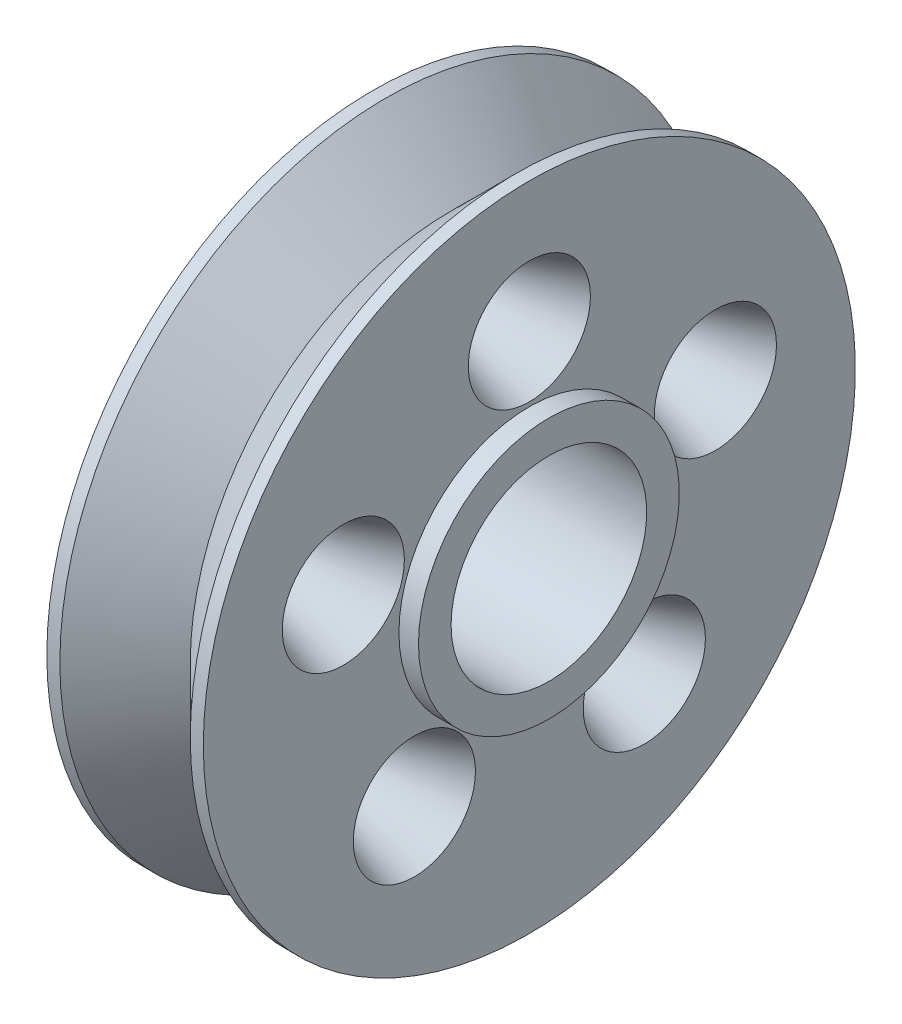
from build123d import *

# Parameters (mm, degrees)
IZIM2_R                           = 5
KES_EKSTR_ZYON3_DEPTH             = 12
KES_EKSTR_ZYON3_TAPER             = -20
KES_EKSTR_ZYON3_OTHER_WAY_DEPTH   = 12
KES_EKSTR_ZYON3_OTHER_WAY_DRAFT   = -20
DAIRESEL_KAPLAMA1_COUNT           = 5
DAIRESEL_KAPLAMA1_COPY_1_SKETCH_R = 5
DAIRESEL_KAPLAMA1_COPY_1_DEPTH    = 12
DAIRESEL_KAPLAMA1_COPY_1_DRAFT    = -20
DAIRESEL_KAPLAMA1_COPY_2_SKETCH_R = 5
DAIRESEL_KAPLAMA1_COPY_2_DEPTH    = 12
DAIRESEL_KAPLAMA1_COPY_2_DRAFT    = -20
DAIRESEL_KAPLAMA1_COPY_3_SKETCH_R = 5
DAIRESEL_KAPLAMA1_COPY_3_DEPTH    = 12
DAIRESEL_KAPLAMA1_COPY_3_DRAFT    = -20
DAIRESEL_KAPLAMA1_COPY_4_SKETCH_R = 5
DAIRESEL_KAPLAMA1_COPY_4_DEPTH    = 12
DAIRESEL_KAPLAMA1_COPY_4_DRAFT    = -20
DAIRESEL_KAPLAMA1_COPY_5_SKETCH_R = 5
DAIRESEL_KAPLAMA1_COPY_5_DEPTH    = 12
DAIRESEL_KAPLAMA1_COPY_5_DRAFT    = -20
DAIRESEL_KAPLAMA1_COPY_6_SKETCH_R = 5
DAIRESEL_KAPLAMA1_COPY_6_DEPTH    = 12
DAIRESEL_KAPLAMA1_COPY_6_DRAFT    = -20
DAIRESEL_KAPLAMA1_COPY_7_SKETCH_R = 5
DAIRESEL_KAPLAMA1_COPY_7_DEPTH    = 12
DAIRESEL_KAPLAMA1_COPY_7_DRAFT    = -20
DAIRESEL_KAPLAMA1_COPY_8_SKETCH_R = 5
DAIRESEL_KAPLAMA1_COPY_8_DEPTH    = 12
DAIRESEL_KAPLAMA1_COPY_8_DRAFT    = -20


with BuildPart() as part:
    # Çizim1 → Döndür1 (revolve)
    with BuildSketch(Plane.XY, mode=Mode.PRIVATE) as d_nd_r1_sk:
        Polygon((-10.136635142, 50), (-0.136635142, 40), (9.863364858, 50), (11.863364858, 50), (11.863364858, 20), (14.863364858, 20), (14.863364858, 15), (11.863364858, 15), (-12.136635142, 15), (-15.136635142, 15), (-15.136635142, 20), (-12.136635142, 20), (-12.136635142, 50), align=None)
    revolve(d_nd_r1_sk.sketch.rotate(Axis((-17.676704828, 0, 0), (1, 0, 0)), 90), axis=Axis((-17.676704828, 0, 0), (1, 0, 0)))

    # Çizim2 → Kes-Ekstrüzyon3 (cut)
    with BuildSketch(Plane(origin=(-0.136635142, 0, 0), x_dir=(0, 0, -1), z_dir=(1, 0, 0))):
        with Locations((0, 30)):
            Circle(IZIM2_R)
    kes_ekstr_zyon3 = extrude(amount=-KES_EKSTR_ZYON3_DEPTH, taper=KES_EKSTR_ZYON3_TAPER, mode=Mode.SUBTRACT)


with BuildPart() as kes_ekstr_zyon3_other_way_tool:
    # Çizim2 → Kes-Ekstrüzyon3 other way (with draft: the straight prism first)
    with BuildSketch(Plane(origin=(-0.136635142, 0, 0), x_dir=(0, 0, -1), z_dir=(1, 0, 0))):
        with Locations((0, 30)):
            Circle(IZIM2_R)
    extrude(amount=KES_EKSTR_ZYON3_OTHER_WAY_DEPTH)
    # Kes-Ekstrüzyon3 other way: the draft: its side faces are tilted about the plane it starts from
    kes_ekstr_zyon3_other_way_sides = [kes_ekstr_zyon3_other_way_tool.faces().sort_by_distance(p)[0] for p in [
        (5.863364858, 30, 5),
    ]]
    draft(kes_ekstr_zyon3_other_way_sides, Plane(origin=(-0.136635142, 0, 0), x_dir=(0, 0, -1), z_dir=(1, 0, 0)), KES_EKSTR_ZYON3_OTHER_WAY_DRAFT)


with BuildPart() as part_1:
    add(part.part)

    # Kes-Ekstrüzyon3 other way: cut by kes_ekstr_zyon3_other_way_tool
    add(kes_ekstr_zyon3_other_way_tool.part, mode=Mode.SUBTRACT)

    # Dairesel Kaplama1: Kes-Ekstrüzyon3 ×5 about axis
    dairesel_kaplama1_axis = Axis((0, 0, 0), (1, 0, 0))
    for i in range(1, DAIRESEL_KAPLAMA1_COUNT):
        add(kes_ekstr_zyon3.rotate(dairesel_kaplama1_axis, i * 360 / DAIRESEL_KAPLAMA1_COUNT), mode=Mode.SUBTRACT)


with BuildPart() as dairesel_kaplama1_copy_1_tool:
    # Dairesel Kaplama1 copy 1 sketch → Dairesel Kaplama1 copy 1 (with draft: the straight prism first)
    with BuildSketch(Plane(origin=(-0.136635142, 0, 0), x_dir=(0, 0.9510565162951535, -0.30901699437494745), z_dir=(1, 0, 0))):
        with Locations((0, 30)):
            Circle(DAIRESEL_KAPLAMA1_COPY_1_SKETCH_R)
    extrude(amount=DAIRESEL_KAPLAMA1_COPY_1_DEPTH)
    # Dairesel Kaplama1 copy 1: the draft: its side faces are tilted about the plane it starts from
    dairesel_kaplama1_copy_1_sides = [dairesel_kaplama1_copy_1_tool.faces().sort_by_distance(p)[0] for p in [
        (5.863364858, 4.51522725, 30.076780461),
    ]]
    draft(dairesel_kaplama1_copy_1_sides, Plane(origin=(-0.136635142, 0, 0), x_dir=(0, 0.9510565162951535, -0.30901699437494745), z_dir=(1, 0, 0)), DAIRESEL_KAPLAMA1_COPY_1_DRAFT)


with BuildPart() as part_2:
    add(part_1.part)

    # Dairesel Kaplama1 copy 1: cut by dairesel_kaplama1_copy_1_tool
    add(dairesel_kaplama1_copy_1_tool.part, mode=Mode.SUBTRACT)


with BuildPart() as dairesel_kaplama1_copy_2_tool:
    # Dairesel Kaplama1 copy 2 sketch → Dairesel Kaplama1 copy 2 (with draft: the straight prism first)
    with BuildSketch(Plane(origin=(-0.136635142, 0, 0), x_dir=(0, 0.5877852522924732, 0.8090169943749473), z_dir=(1, 0, 0))):
        with Locations((0, 30)):
            Circle(DAIRESEL_KAPLAMA1_COPY_2_SKETCH_R)
    extrude(amount=DAIRESEL_KAPLAMA1_COPY_2_DEPTH)
    # Dairesel Kaplama1 copy 2: the draft: its side faces are tilted about the plane it starts from
    dairesel_kaplama1_copy_2_sides = [dairesel_kaplama1_copy_2_tool.faces().sort_by_distance(p)[0] for p in [
        (5.863364858, -27.209436093, 13.588472597),
    ]]
    draft(dairesel_kaplama1_copy_2_sides, Plane(origin=(-0.136635142, 0, 0), x_dir=(0, 0.5877852522924732, 0.8090169943749473), z_dir=(1, 0, 0)), DAIRESEL_KAPLAMA1_COPY_2_DRAFT)


with BuildPart() as part_3:
    add(part_2.part)

    # Dairesel Kaplama1 copy 2: cut by dairesel_kaplama1_copy_2_tool
    add(dairesel_kaplama1_copy_2_tool.part, mode=Mode.SUBTRACT)


with BuildPart() as dairesel_kaplama1_copy_3_tool:
    # Dairesel Kaplama1 copy 3 sketch → Dairesel Kaplama1 copy 3 (with draft: the straight prism first)
    with BuildSketch(Plane(origin=(-0.136635142, 0, 0), x_dir=(0, -0.587785252292473, 0.8090169943749476), z_dir=(1, 0, 0))):
        with Locations((0, 30)):
            Circle(DAIRESEL_KAPLAMA1_COPY_3_SKETCH_R)
    extrude(amount=DAIRESEL_KAPLAMA1_COPY_3_DEPTH)
    # Dairesel Kaplama1 copy 3: the draft: its side faces are tilted about the plane it starts from
    dairesel_kaplama1_copy_3_sides = [dairesel_kaplama1_copy_3_tool.faces().sort_by_distance(p)[0] for p in [
        (5.863364858, -21.33158357, -21.678642541),
    ]]
    draft(dairesel_kaplama1_copy_3_sides, Plane(origin=(-0.136635142, 0, 0), x_dir=(0, -0.587785252292473, 0.8090169943749476), z_dir=(1, 0, 0)), DAIRESEL_KAPLAMA1_COPY_3_DRAFT)


with BuildPart() as part_4:
    add(part_3.part)

    # Dairesel Kaplama1 copy 3: cut by dairesel_kaplama1_copy_3_tool
    add(dairesel_kaplama1_copy_3_tool.part, mode=Mode.SUBTRACT)


with BuildPart() as dairesel_kaplama1_copy_4_tool:
    # Dairesel Kaplama1 copy 4 sketch → Dairesel Kaplama1 copy 4 (with draft: the straight prism first)
    with BuildSketch(Plane(origin=(-0.136635142, 0, 0), x_dir=(0, -0.9510565162951536, -0.30901699437494723), z_dir=(1, 0, 0))):
        with Locations((0, 30)):
            Circle(DAIRESEL_KAPLAMA1_COPY_4_SKETCH_R)
    extrude(amount=DAIRESEL_KAPLAMA1_COPY_4_DEPTH)
    # Dairesel Kaplama1 copy 4: the draft: its side faces are tilted about the plane it starts from
    dairesel_kaplama1_copy_4_sides = [dairesel_kaplama1_copy_4_tool.faces().sort_by_distance(p)[0] for p in [
        (5.863364858, 14.025792413, -26.986610517),
    ]]
    draft(dairesel_kaplama1_copy_4_sides, Plane(origin=(-0.136635142, 0, 0), x_dir=(0, -0.9510565162951536, -0.30901699437494723), z_dir=(1, 0, 0)), DAIRESEL_KAPLAMA1_COPY_4_DRAFT)


with BuildPart() as part_5:
    add(part_4.part)

    # Dairesel Kaplama1 copy 4: cut by dairesel_kaplama1_copy_4_tool
    add(dairesel_kaplama1_copy_4_tool.part, mode=Mode.SUBTRACT)


with BuildPart() as dairesel_kaplama1_copy_5_tool:
    # Dairesel Kaplama1 copy 5 sketch → Dairesel Kaplama1 copy 5 (with draft: the straight prism first)
    with BuildSketch(Plane(origin=(-0.136635142, 0, 0), x_dir=(0, 0.9510565162951535, -0.30901699437494745), z_dir=(1, 0, 0))):
        with Locations((0, 30)):
            Circle(DAIRESEL_KAPLAMA1_COPY_5_SKETCH_R)
    extrude(amount=DAIRESEL_KAPLAMA1_COPY_5_DEPTH)
    # Dairesel Kaplama1 copy 5: the draft: its side faces are tilted about the plane it starts from
    dairesel_kaplama1_copy_5_sides = [dairesel_kaplama1_copy_5_tool.faces().sort_by_distance(p)[0] for p in [
        (5.863364858, 4.51522725, 30.076780461),
    ]]
    draft(dairesel_kaplama1_copy_5_sides, Plane(origin=(-0.136635142, 0, 0), x_dir=(0, 0.9510565162951535, -0.30901699437494745), z_dir=(1, 0, 0)), DAIRESEL_KAPLAMA1_COPY_5_DRAFT)


with BuildPart() as part_6:
    add(part_5.part)

    # Dairesel Kaplama1 copy 5: cut by dairesel_kaplama1_copy_5_tool
    add(dairesel_kaplama1_copy_5_tool.part, mode=Mode.SUBTRACT)


with BuildPart() as dairesel_kaplama1_copy_6_tool:
    # Dairesel Kaplama1 copy 6 sketch → Dairesel Kaplama1 copy 6 (with draft: the straight prism first)
    with BuildSketch(Plane(origin=(-0.136635142, 0, 0), x_dir=(0, 0.5877852522924732, 0.8090169943749473), z_dir=(1, 0, 0))):
        with Locations((0, 30)):
            Circle(DAIRESEL_KAPLAMA1_COPY_6_SKETCH_R)
    extrude(amount=DAIRESEL_KAPLAMA1_COPY_6_DEPTH)
    # Dairesel Kaplama1 copy 6: the draft: its side faces are tilted about the plane it starts from
    dairesel_kaplama1_copy_6_sides = [dairesel_kaplama1_copy_6_tool.faces().sort_by_distance(p)[0] for p in [
        (5.863364858, -27.209436093, 13.588472597),
    ]]
    draft(dairesel_kaplama1_copy_6_sides, Plane(origin=(-0.136635142, 0, 0), x_dir=(0, 0.5877852522924732, 0.8090169943749473), z_dir=(1, 0, 0)), DAIRESEL_KAPLAMA1_COPY_6_DRAFT)


with BuildPart() as part_7:
    add(part_6.part)

    # Dairesel Kaplama1 copy 6: cut by dairesel_kaplama1_copy_6_tool
    add(dairesel_kaplama1_copy_6_tool.part, mode=Mode.SUBTRACT)


with BuildPart() as dairesel_kaplama1_copy_7_tool:
    # Dairesel Kaplama1 copy 7 sketch → Dairesel Kaplama1 copy 7 (with draft: the straight prism first)
    with BuildSketch(Plane(origin=(-0.136635142, 0, 0), x_dir=(0, -0.587785252292473, 0.8090169943749476), z_dir=(1, 0, 0))):
        with Locations((0, 30)):
            Circle(DAIRESEL_KAPLAMA1_COPY_7_SKETCH_R)
    extrude(amount=DAIRESEL_KAPLAMA1_COPY_7_DEPTH)
    # Dairesel Kaplama1 copy 7: the draft: its side faces are tilted about the plane it starts from
    dairesel_kaplama1_copy_7_sides = [dairesel_kaplama1_copy_7_tool.faces().sort_by_distance(p)[0] for p in [
        (5.863364858, -21.33158357, -21.678642541),
    ]]
    draft(dairesel_kaplama1_copy_7_sides, Plane(origin=(-0.136635142, 0, 0), x_dir=(0, -0.587785252292473, 0.8090169943749476), z_dir=(1, 0, 0)), DAIRESEL_KAPLAMA1_COPY_7_DRAFT)


with BuildPart() as part_8:
    add(part_7.part)

    # Dairesel Kaplama1 copy 7: cut by dairesel_kaplama1_copy_7_tool
    add(dairesel_kaplama1_copy_7_tool.part, mode=Mode.SUBTRACT)


with BuildPart() as dairesel_kaplama1_copy_8_tool:
    # Dairesel Kaplama1 copy 8 sketch → Dairesel Kaplama1 copy 8 (with draft: the straight prism first)
    with BuildSketch(Plane(origin=(-0.136635142, 0, 0), x_dir=(0, -0.9510565162951536, -0.30901699437494723), z_dir=(1, 0, 0))):
        with Locations((0, 30)):
            Circle(DAIRESEL_KAPLAMA1_COPY_8_SKETCH_R)
    extrude(amount=DAIRESEL_KAPLAMA1_COPY_8_DEPTH)
    # Dairesel Kaplama1 copy 8: the draft: its side faces are tilted about the plane it starts from
    dairesel_kaplama1_copy_8_sides = [dairesel_kaplama1_copy_8_tool.faces().sort_by_distance(p)[0] for p in [
        (5.863364858, 14.025792413, -26.986610517),
    ]]
    draft(dairesel_kaplama1_copy_8_sides, Plane(origin=(-0.136635142, 0, 0), x_dir=(0, -0.9510565162951536, -0.30901699437494723), z_dir=(1, 0, 0)), DAIRESEL_KAPLAMA1_COPY_8_DRAFT)


with BuildPart() as part_9:
    add(part_8.part)

    # Dairesel Kaplama1 copy 8: cut by dairesel_kaplama1_copy_8_tool
    add(dairesel_kaplama1_copy_8_tool.part, mode=Mode.SUBTRACT)


solid = part_9.part
